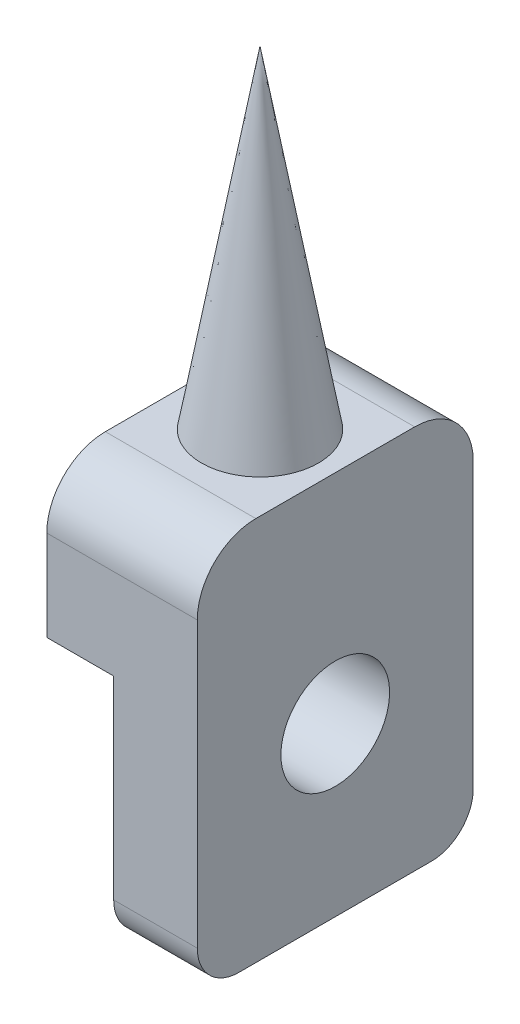
from build123d import *

# Parameters (mm, degrees)
SKETCH1_W           = 18
SKETCH1_H           = 33
BOSS_EXTRUDE1_DEPTH = 46
CUT_EXTRUDE1_DEPTH  = 8
SKETCH4_R           = 6.5
CUT_EXTRUDE2_DEPTH  = 10
FILLET3_R           = 5
FILLET4_R           = 7
CUT_EXTRUDE3_DEPTH  = 8


with BuildPart() as part:
    # Sketch1 → Boss-Extrude1 (new body)
    with BuildSketch(Plane(origin=(0, 0, 0), x_dir=(1, 0, 0), z_dir=(0, 1, 0))):
        Rectangle(SKETCH1_W, SKETCH1_H)
    extrude(amount=BOSS_EXTRUDE1_DEPTH)

    # Boss-Extrude2 cone 1 section (through the dimple's axis) → Boss-Extrude2 (revolve)
    with BuildSketch(Plane(origin=(0, 46, 0), x_dir=(0, 0, -1), z_dir=(1, 0, 0))):
        Polygon((0, 0), (7, 0), (0, 39.698972737), align=None)
    revolve(axis=Axis((0, 46, 0), (0, 1, 0)))

    # Sketch3 → Cut-Extrude1 (cut)
    with BuildSketch(Plane.ZY.offset(9)):
        with BuildLine():
            Line((-16.5, 0), (16.5, 0))
            Line((16.5, 0), (16.5, 20))
            ThreePointArc((16.5, 20), (0, 36.5), (-16.5, 20))
            Line((-16.5, 20), (-16.5, 0))
        make_face()
    extrude(amount=-CUT_EXTRUDE1_DEPTH, mode=Mode.SUBTRACT)

    # Sketch4 → Cut-Extrude2 (cut)
    with BuildSketch(Plane.ZY.offset(1)):
        with Locations((0, 20)):
            Circle(SKETCH4_R)
    extrude(amount=-CUT_EXTRUDE2_DEPTH, mode=Mode.SUBTRACT)

    # Fillet3
    fillet3_edges = [part.edges().sort_by_distance(p)[0] for p in [
        (4, 0, 16.5),
        (4, 0, -16.5),
    ]]
    fillet(fillet3_edges, radius=FILLET3_R)

    # Fillet4
    fillet4_edges = [part.edges().sort_by_distance(p)[0] for p in [
        (0, 46, 16.5),
        (0, 46, -16.5),
    ]]
    fillet(fillet4_edges, radius=FILLET4_R)

    # Sketch6 → Cut-Extrude3 (cut)
    with BuildSketch(Plane.ZY.offset(9)):
        with BuildLine():
            Line((-16.5, 20), (16.5, 20))
            Line((16.5, 20), (16.5, 28.185352772))
            ThreePointArc((16.5, 28.185352772), (0, 41.092676386), (-16.5, 28.185352772))
            Line((-16.5, 28.185352772), (-16.5, 20))
        make_face()
    extrude(amount=-CUT_EXTRUDE3_DEPTH, mode=Mode.SUBTRACT)


solid = part.part
